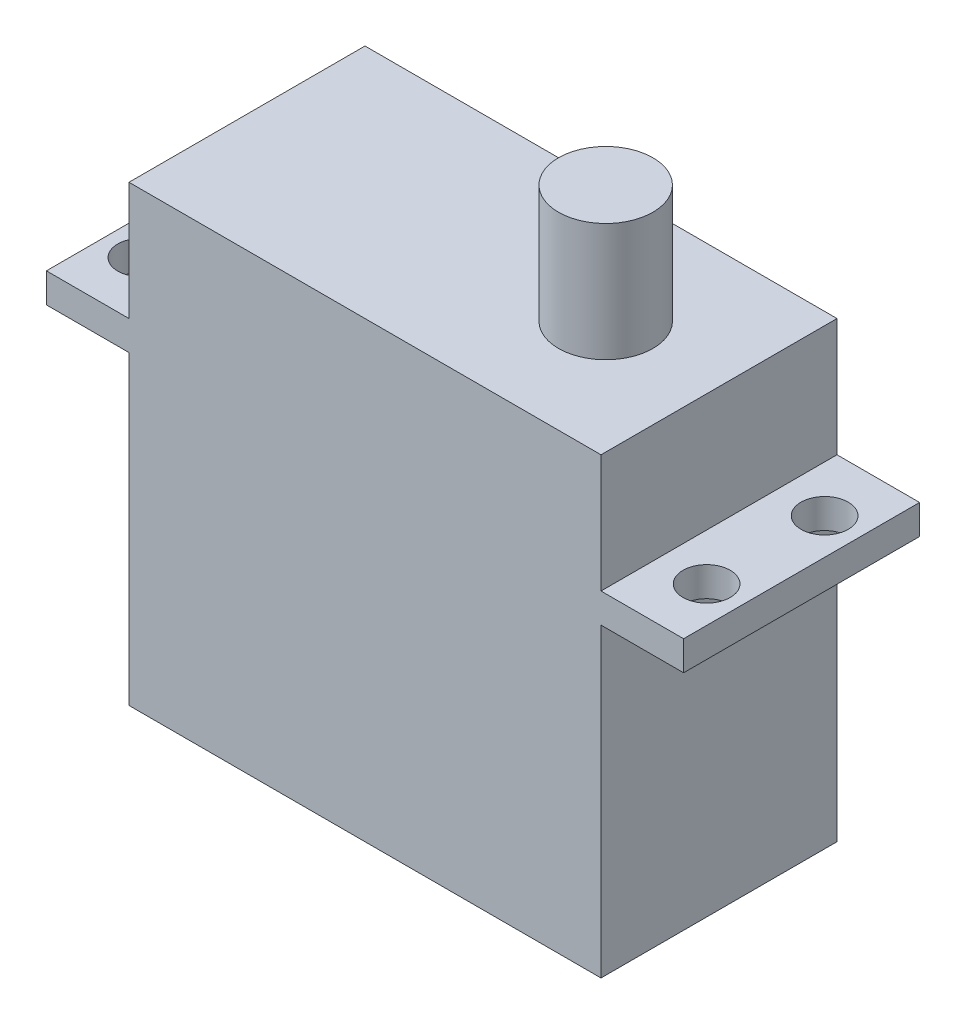
from build123d import *

# Parameters (mm, degrees)
SKETCH1_W           = 40
SKETCH1_H           = 20
BOSS_EXTRUDE1_DEPTH = 25.9
SKETCH2_W           = 54
SKETCH2_H           = 20
SKETCH2_R           = 2
BOSS_EXTRUDE2_DEPTH = 2.5
SKETCH3_W           = 40
SKETCH3_H           = 20
BOSS_EXTRUDE3_DEPTH = 10
SKETCH4_R           = 4
BOSS_EXTRUDE4_DEPTH = 10


with BuildPart() as part:
    # Sketch1 → Boss-Extrude1 (new body)
    with BuildSketch(Plane(origin=(0, 0, 0), x_dir=(1, 0, 0), z_dir=(0, 1, 0))):
        Rectangle(SKETCH1_W, SKETCH1_H)
    extrude(amount=BOSS_EXTRUDE1_DEPTH)

    # Sketch2 → Boss-Extrude2 (add)
    with BuildSketch(Plane(origin=(0, 25.9, 0), x_dir=(1, 0, 0), z_dir=(0, 1, 0))):
        Rectangle(SKETCH2_W, SKETCH2_H)
        with Locations(Location((-23.95, 5, 0), (0, 0, 270))):
            Circle(SKETCH2_R, mode=Mode.SUBTRACT)
        with Locations(Location((-23.95, -5, 0), (0, 0, 270))):
            Circle(SKETCH2_R, mode=Mode.SUBTRACT)
        with Locations(Location((23.95, 5, 0), (0, 0, 270))):
            Circle(SKETCH2_R, mode=Mode.SUBTRACT)
        with Locations(Location((23.95, -5, 0), (0, 0, 270))):
            Circle(SKETCH2_R, mode=Mode.SUBTRACT)
    extrude(amount=BOSS_EXTRUDE2_DEPTH)

    # Sketch3 → Boss-Extrude3 (add)
    with BuildSketch(Plane(origin=(0, 28.4, 0), x_dir=(1, 0, 0), z_dir=(0, 1, 0))):
        Rectangle(SKETCH3_W, SKETCH3_H)
    extrude(amount=BOSS_EXTRUDE3_DEPTH)

    # Sketch4 → Boss-Extrude4 (add)
    with BuildSketch(Plane(origin=(0, 38.4, 0), x_dir=(1, 0, 0), z_dir=(0, 1, 0))):
        with Locations(Location((10.4, 0, 0), (0, 0, 270))):
            Circle(SKETCH4_R)
    extrude(amount=BOSS_EXTRUDE4_DEPTH)


solid = part.part
